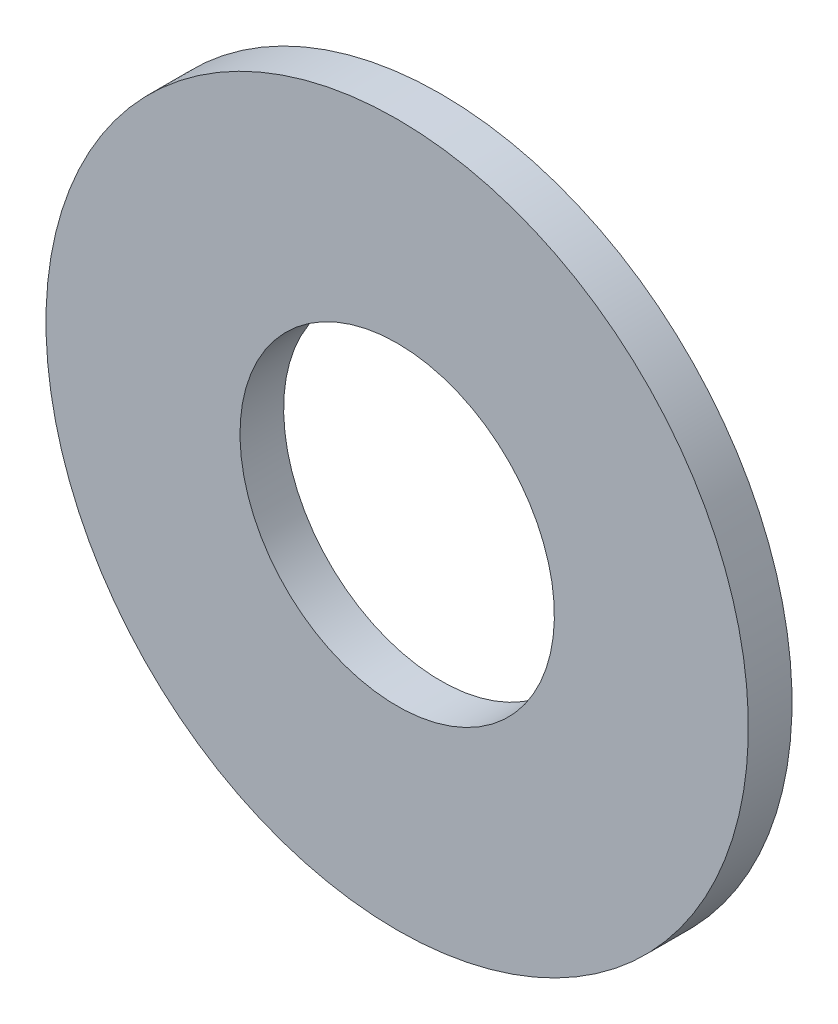
from build123d import *

# Parameters (mm, degrees)
SKETCH2_W = 0.889
SKETCH2_H = 3.9497


with BuildPart() as part:
    # Sketch2 → Revolve1 (revolve)
    with BuildSketch(Plane(origin=(0, 0, 0), x_dir=(0, 0, -1), z_dir=(1, 0, 0))):
        with Locations((-0.4445, 5.17525)):
            Rectangle(SKETCH2_W, SKETCH2_H)
    revolve(axis=Axis((0, 0, 0.889), (0, 0, 1)))


solid = part.part
